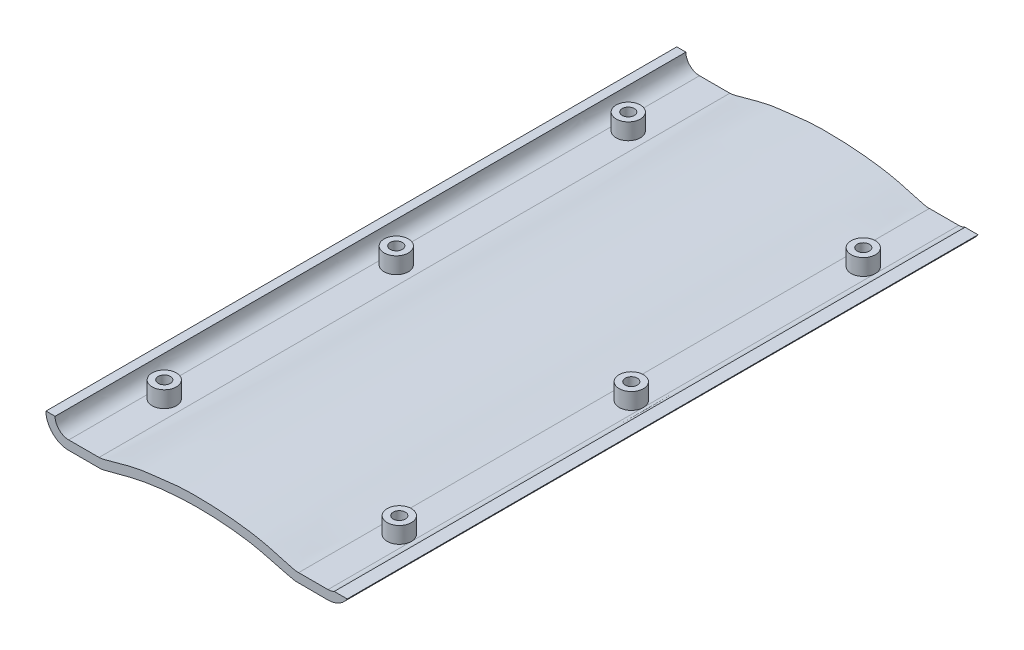
from build123d import *

# Parameters (mm, degrees)
BOSS_EXTRUDE1_DEPTH  = 104
SKETCH3_R            = 4
BOSS_EXTRUDE2_DEPTH  = 5.39
LPATTERN1_COUNT      = 2
LPATTERN1_PITCH      = 77.5
LPATTERN1_COUNT_DIR2 = 3
LPATTERN1_PITCH_DIR2 = 76.5
SKETCH4_R            = 2
CUT_EXTRUDE1_DEPTH   = 20
LPATTERN2_COUNT      = 2
LPATTERN2_PITCH      = 77.5
LPATTERN2_COUNT_DIR2 = 3
LPATTERN2_PITCH_DIR2 = 76.5


with BuildPart() as part:
    # Sketch1 → Boss-Extrude1 (new, symmetric)
    with BuildSketch(Plane.XY):
        with BuildLine():
            Line((-63.254838152, 42.196894229), (-60.254838151, 42.196894229))
            add(Edge.make_bspline(
                [(-60.254838151, 42.196894229), (-60.329264926, 39.784862755), (-58.142715816, 37.633289597), (-55.754838152, 37.69689423)],
                knots=[0, 0, 0, 0, 1, 1, 1, 1], degree=3))
            Line((-55.754838152, 37.69689423), (-45.754838152, 37.69689423))
            add(Edge.make_bspline(
                [(-45.754838152, 37.69689423), (-44.875473051, 37.707491111), (-42.386433764, 38.433393637), (-38.080119079, 39.594977773), (-32.188653568, 41.120188922), (-26.104143006, 41.68197351), (-19.564125077, 42.606581313), (-11.810063986, 42.740596525), (-2.211890109, 42.283160538), (7.936793179, 40.853303281), (15.200404148, 38.753545069), (19.055304565, 37.64933418), (20.045487602, 37.69689423)],
                knots=[0, 0, 0, 0, 0.039252952, 0.11565295, 0.201008579, 0.31187983, 0.389596687, 0.497602979, 0.659471417, 0.821339854, 0.95595608, 1, 1, 1, 1], degree=3))
            Line((20.045487602, 37.69689423), (29.724965073, 37.69689423))
            add(Edge.make_bspline(
                [(29.724965073, 37.69689423), (30.815676556, 37.700509578), (31.78685675, 38.196971319)],
                knots=[0, 0, 0, 1, 1, 1], degree=2))
            Line((31.78685675, 38.196971319), (36.069253843, 38.196894229))
            add(Edge.make_bspline(
                [(29.724965073, 34.696894229), (33.798509062, 34.812968691), (36.069253843, 38.196894229)],
                knots=[0, 0, 0, 1, 1, 1], degree=2))
            Line((29.724965073, 34.696894229), (18.851468399, 34.747934332))
            add(Edge.make_bspline(
                [(-45.754838152, 34.69689423), (-44.652794726, 34.68924452), (-41.838910122, 35.446259309), (-36.731285597, 36.898501292), (-30.395795221, 38.318638074), (-22.273686834, 39.354822364), (-13.013073921, 39.846747063), (-3.436769501, 39.320018707), (7.290044136, 37.992463173), (14.237919884, 35.675228926), (18.851468399, 34.747934332)],
                knots=[0, 0, 0, 0, 0.050080657, 0.132344158, 0.243528071, 0.346436056, 0.506687839, 0.666939622, 0.78474744, 1, 1, 1, 1], degree=3))
            Line((-45.754838152, 34.69689423), (-55.754838152, 34.69689423))
            add(Edge.make_bspline(
                [(-63.254838152, 42.196894229), (-63.36827312, 38.165513891), (-59.751197584, 34.596760073), (-55.754838152, 34.69689423)],
                knots=[0, 0, 0, 0, 1, 1, 1, 1], degree=3))
        make_face()
    extrude(amount=BOSS_EXTRUDE1_DEPTH, both=True)

    # Sketch3 → Boss-Extrude2 (add)
    with BuildSketch(Plane(origin=(0, 37.69689423, 0), x_dir=(1, 0, 0), z_dir=(0, 1, 0))):
        with Locations(Location((-51.754838152, -76.5, 0), (0, 0, 180))):
            Circle(SKETCH3_R)
    boss_extrude2 = extrude(amount=BOSS_EXTRUDE2_DEPTH)

    # LPattern1: Boss-Extrude2 2 × 3
    with Locations(*[(i * LPATTERN1_PITCH, 0, -j * LPATTERN1_PITCH_DIR2) for i in range(LPATTERN1_COUNT) for j in range(LPATTERN1_COUNT_DIR2) if (i, j) != (0, 0)]):
        add(boss_extrude2)

    # Sketch4 → Cut-Extrude1 (cut)
    with BuildSketch(Plane(origin=(0, 43.08689423, 0), x_dir=(1, 0, 0), z_dir=(0, 1, 0))):
        with Locations(Location((-51.754838152, -76.5, 0), (0, 0, 180))):
            Circle(SKETCH4_R)
    cut_extrude1 = extrude(amount=-CUT_EXTRUDE1_DEPTH, mode=Mode.SUBTRACT)

    # LPattern2: Cut-Extrude1 2 × 3
    with Locations(*[(i * LPATTERN2_PITCH, 0, -j * LPATTERN2_PITCH_DIR2) for i in range(LPATTERN2_COUNT) for j in range(LPATTERN2_COUNT_DIR2) if (i, j) != (0, 0)]):
        add(cut_extrude1, mode=Mode.SUBTRACT)


solid = part.part
